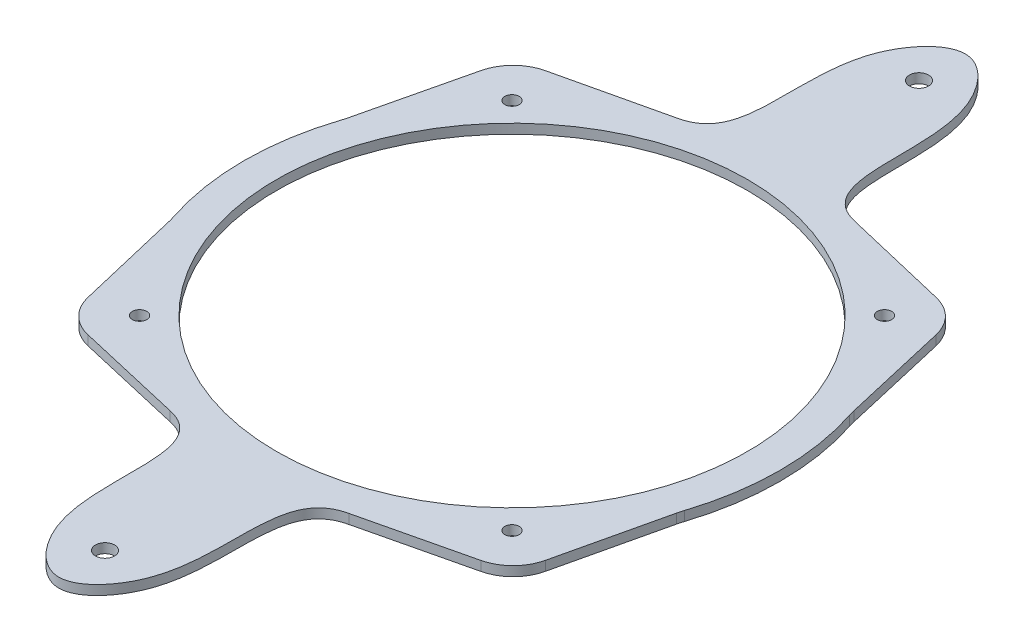
from build123d import *

# Parameters (mm, degrees)
SKETCH1_R           = 1.5
SKETCH1_R_2         = 49.2
SKETCH1_R_3         = 2
BOSS_EXTRUDE1_DEPTH = 2


with BuildPart() as part:
    # Sketch1 → Boss-Extrude1 (new body)
    with BuildSketch(Plane(origin=(0, 0, 0), x_dir=(1, 0, 0), z_dir=(0, 1, 0))):
        with BuildLine():
            Line((-40.816401641, 47.763274249), (-18.536148639, 52.922119493))
            add(Edge.make_bspline(
                [(-18.536148639, 52.922119493), (-6.536634723, 55.455425009), (-17.450586635, 79.503274209), (0.00798679, 98.683842699), (17.436525911, 79.432784357), (6.796227586, 55.436120512), (18.82031265, 52.821731984)],
                knots=[0, 0, 0, 0, 0.366190046, 0.499165373, 0.6321407, 1, 1, 1, 1], degree=3))
            Line((18.82031265, 52.821731984), (41.072517471, 47.543215273))
            ThreePointArc((41.072517471, 47.543215273), (45.376282852, 45.133058333), (47.763274249, 40.816401641))
            Line((47.763274249, 40.816401641), (52.922119493, 18.536148639))
            ThreePointArc((52.922119493, 18.536148639), (53.089772901, 17.876292735), (53.285345919, 17.224166462))
            ThreePointArc((53.285345919, 17.224166462), (56, 0), (53.285345919, -17.224166462))
            ThreePointArc((53.285345919, -17.224166462), (53.089772901, -17.876292735), (52.922119493, -18.536148639))
            Line((52.922119493, -18.536148639), (47.763274249, -40.816401641))
            ThreePointArc((47.763274249, -40.816401641), (45.376282852, -45.133058333), (41.072517471, -47.543215273))
            Line((41.072517471, -47.543215273), (18.82031265, -52.821731984))
            add(Edge.make_bspline(
                [(-18.536148639, -52.922119493), (-6.536634723, -55.455425009), (-17.450586635, -79.503274209), (0.00798679, -98.683842699), (17.436525911, -79.432784357), (6.796227586, -55.436120512), (18.82031265, -52.821731984)],
                knots=[0, 0, 0, 0, 0.366190046, 0.499165373, 0.6321407, 1, 1, 1, 1], degree=3))
            Line((-18.536148639, -52.922119493), (-40.816401641, -47.763274249))
            ThreePointArc((-40.816401641, -47.763274249), (-45.133058333, -45.376282852), (-47.543215273, -41.072517471))
            Line((-47.543215273, -41.072517471), (-52.821731984, -18.82031265))
            ThreePointArc((-52.821731984, -18.82031265), (-52.992929389, -18.161367335), (-53.192004456, -17.510301595))
            ThreePointArc((-53.192004456, -17.510301595), (-56, 0), (-53.192004456, 17.510301595))
            ThreePointArc((-53.192004456, 17.510301595), (-52.992929389, 18.161367335), (-52.821731984, 18.82031265))
            Line((-52.821731984, 18.82031265), (-47.543215273, 41.072517471))
            ThreePointArc((-47.543215273, 41.072517471), (-45.133058333, 45.376282852), (-40.816401641, 47.763274249))
        make_face()
        with Locations(Location((-38.8907, 38.8907, 0), (0, 0, 270))):
            Circle(SKETCH1_R, mode=Mode.SUBTRACT)
        with Locations(Location((38.8907, 38.8907, 0), (0, 0, 90))):
            Circle(SKETCH1_R, mode=Mode.SUBTRACT)
        with Locations(Location((38.8907, -38.8907, 0), (0, 0, 270))):
            Circle(SKETCH1_R, mode=Mode.SUBTRACT)
        with Locations(Location((-38.8907, -38.8907, 0), (0, 0, 90))):
            Circle(SKETCH1_R, mode=Mode.SUBTRACT)
        with Locations(Location((0, 0, 0), (0, 0, 270))):
            Circle(SKETCH1_R_2, mode=Mode.SUBTRACT)
        with Locations(Location((0, 85, 0), (0, 0, 270))):
            Circle(SKETCH1_R_3, mode=Mode.SUBTRACT)
        with Locations(Location((0, -85, 0), (0, 0, 90))):
            Circle(SKETCH1_R_3, mode=Mode.SUBTRACT)
    extrude(amount=BOSS_EXTRUDE1_DEPTH)


solid = part.part
